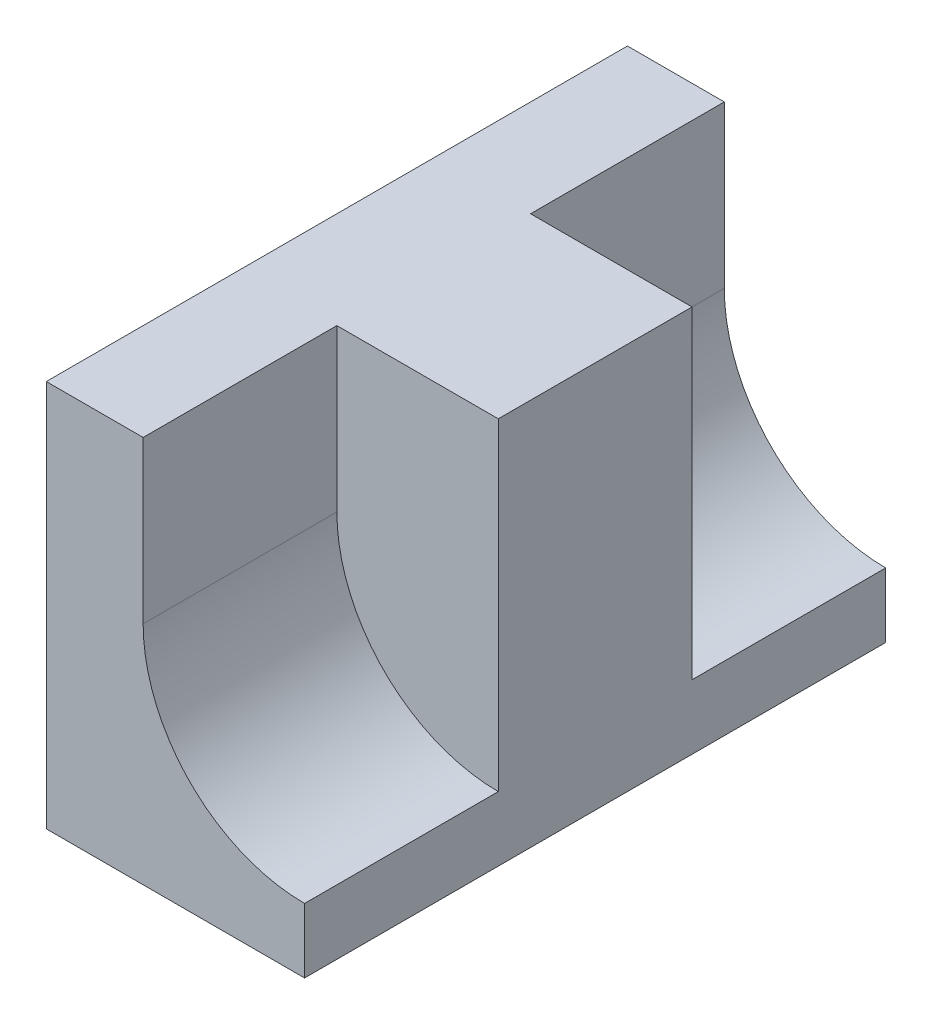
from build123d import *

# Parameters (mm, degrees)
BOSS_EXTRUDE1_DEPTH = 45
BOSS_EXTRUDE2_DEPTH = 15


with BuildPart() as part:
    # Sketch1 → Boss-Extrude1 (new, symmetric)
    with BuildSketch(Plane.XY):
        with BuildLine():
            Line((0, 0), (40, 0))
            Line((40, 0), (40, 10))
            ThreePointArc((40, 10), (22.32233047, 17.32233047), (15, 35))
            Line((15, 35), (15, 60))
            Line((15, 60), (0, 60))
            Line((0, 60), (0, 0))
        make_face()
    extrude(amount=BOSS_EXTRUDE1_DEPTH, both=True)

    # Sketch1<3> → Boss-Extrude2 (add, symmetric)
    with BuildSketch(Plane.XY):
        with BuildLine():
            ThreePointArc((15, 35), (22.32233047, 17.32233047), (40, 10))
            Line((40, 10), (40, 60))
            Line((40, 60), (15, 60))
            Line((15, 60), (15, 35))
        make_face()
    extrude(amount=BOSS_EXTRUDE2_DEPTH, both=True)


solid = part.part
